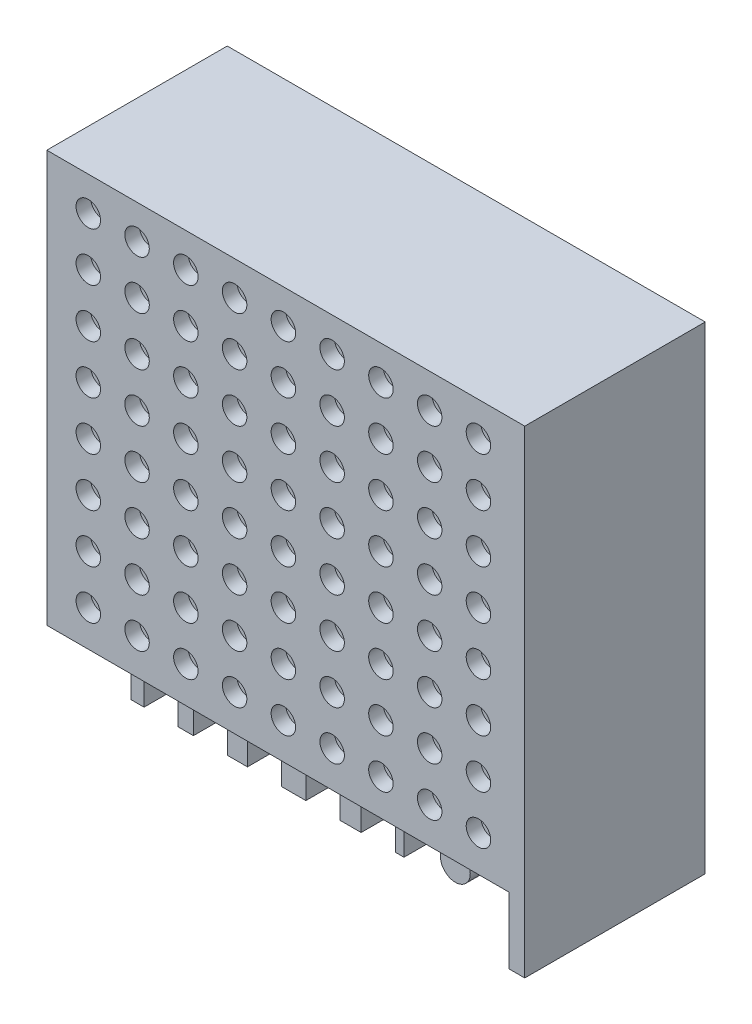
from build123d import *

# Parameters (mm, degrees)
SKETCH_1_W                  = 98
SKETCH_1_H                  = 98
EXTRUDE_1_DEPTH             = 37
SKETCH_2_W                  = 94.797029907
SKETCH_2_H                  = 13.630932302
CUT_EXTRUDE_1_DEPTH         = 15
SKETCH_3_R                  = 3.061197389
SKETCH_3_W                  = 55.933114495
SKETCH_3_H                  = 8.351830186
EXTRUDE_2_DEPTH             = 8
SKETCH_4_W                  = 7
SKETCH_4_H                  = 8.351830186
CUT_EXTRUDE_2_DEPTH         = 5
SKETCH_5_R                  = 1.963728914
SKETCH_5_R_2                = 2.092021752
SKETCH_5_R_3                = 2.148216497
SKETCH_5_R_4                = 2.189056762
SKETCH_5_R_5                = 2.313503663
EXTRUDE_3_DEPTH             = 1.5
M3X0_5_1_D                  = 2.5
M3X0_5_1_DEPTH              = 7.5
M3X0_5_1_TIP                = 0.751075774
SKETCH_8_R                  = 2.508444518
CUT_EXTRUDE_3_DEPTH         = 3
PATTERN_LINEAR_1_COUNT      = 9
PATTERN_LINEAR_1_PITCH      = 10
PATTERN_LINEAR_1_COUNT_DIR2 = 8
PATTERN_LINEAR_1_PITCH_DIR2 = 10


with BuildPart() as part:
    # 草图1 → 凸台-拉伸1 (new body)
    with BuildSketch(Plane.XY):
        Rectangle(SKETCH_1_W, SKETCH_1_H)
    extrude(amount=EXTRUDE_1_DEPTH)

    # 草图2 → 切除-拉伸1 (cut)
    with BuildSketch(Plane.XY.offset(37)):
        with Locations((-1.601485046, -42.184533849)):
            Rectangle(SKETCH_2_W, SKETCH_2_H)
    extrude(amount=-CUT_EXTRUDE_1_DEPTH, mode=Mode.SUBTRACT)

    # 草图3 → 凸台-拉伸2 (add)
    with BuildSketch(Plane.XY.offset(22)):
        with Locations(Location((27.768110373, -43.061503969, 0), (0, 0, 180))):
            Circle(SKETCH_3_R)
        with Locations((-10.728965893, -42.765976058)):
            Rectangle(SKETCH_3_W, SKETCH_3_H)
    extrude(amount=EXTRUDE_2_DEPTH)

    # 草图4 → 切除-拉伸2 (cut)
    with BuildSketch(Plane.XY.offset(30)):
        with Locations((-32.561035158, -42.765976058)):
            Rectangle(SKETCH_4_W, SKETCH_4_H)
        with Locations((-22.440856077, -42.765976058)):
            Rectangle(SKETCH_4_W, SKETCH_4_H)
        with Locations((-11.353140791, -42.765976058)):
            Rectangle(SKETCH_4_W, SKETCH_4_H)
        with Locations((0.617502891, -42.765976058)):
            Rectangle(SKETCH_4_W, SKETCH_4_H)
        with Locations((11.953006531, -42.765976058)):
            Rectangle(SKETCH_4_W, SKETCH_4_H)
    extrude(amount=-CUT_EXTRUDE_2_DEPTH, mode=Mode.SUBTRACT)

    # 草图5 → 凸台-拉伸3 (add)
    with BuildSketch(Plane.XY.offset(25)):
        with Locations((-32.651981543, -42.677063305)):
            Circle(SKETCH_5_R)
        with Locations((-22.122138724, -42.677063305)):
            Circle(SKETCH_5_R_2)
        with Locations((-11.522561848, -42.677063305)):
            Circle(SKETCH_5_R_3)
        with Locations((0, -42.677063305)):
            Circle(SKETCH_5_R_4)
        with Locations((11.88018815, -42.677063305)):
            Circle(SKETCH_5_R_5)
    extrude(amount=EXTRUDE_3_DEPTH)

    # M3x0.5 螺纹孔1
    with Locations(Plane(origin=(0, 0, 0), x_dir=(-1, 0, 0), z_dir=(0, 0, -1))):
        with Locations((-3, 25), (-3, -30)):
            Hole(M3X0_5_1_D / 2, depth=M3X0_5_1_DEPTH)
            with Locations((0, 0, -(M3X0_5_1_DEPTH + M3X0_5_1_TIP / 2))):  # 118° drill point
                Cone(0, M3X0_5_1_D / 2, M3X0_5_1_TIP, mode=Mode.SUBTRACT)

    # 草图8 → 切除-拉伸3 (cut)
    with BuildSketch(Plane.XY.offset(37)):
        with Locations((-40.493461498, 42.016445669)):
            Circle(SKETCH_8_R)
    cut_extrude_3 = extrude(amount=-CUT_EXTRUDE_3_DEPTH, mode=Mode.SUBTRACT)

    # 阵列(线性)1: Cut-Extrude 3 9 × 8
    with Locations(*[(i * PATTERN_LINEAR_1_PITCH, -j * PATTERN_LINEAR_1_PITCH_DIR2, 0) for i in range(PATTERN_LINEAR_1_COUNT) for j in range(PATTERN_LINEAR_1_COUNT_DIR2) if (i, j) != (0, 0)]):
        add(cut_extrude_3, mode=Mode.SUBTRACT)


solid = part.part
